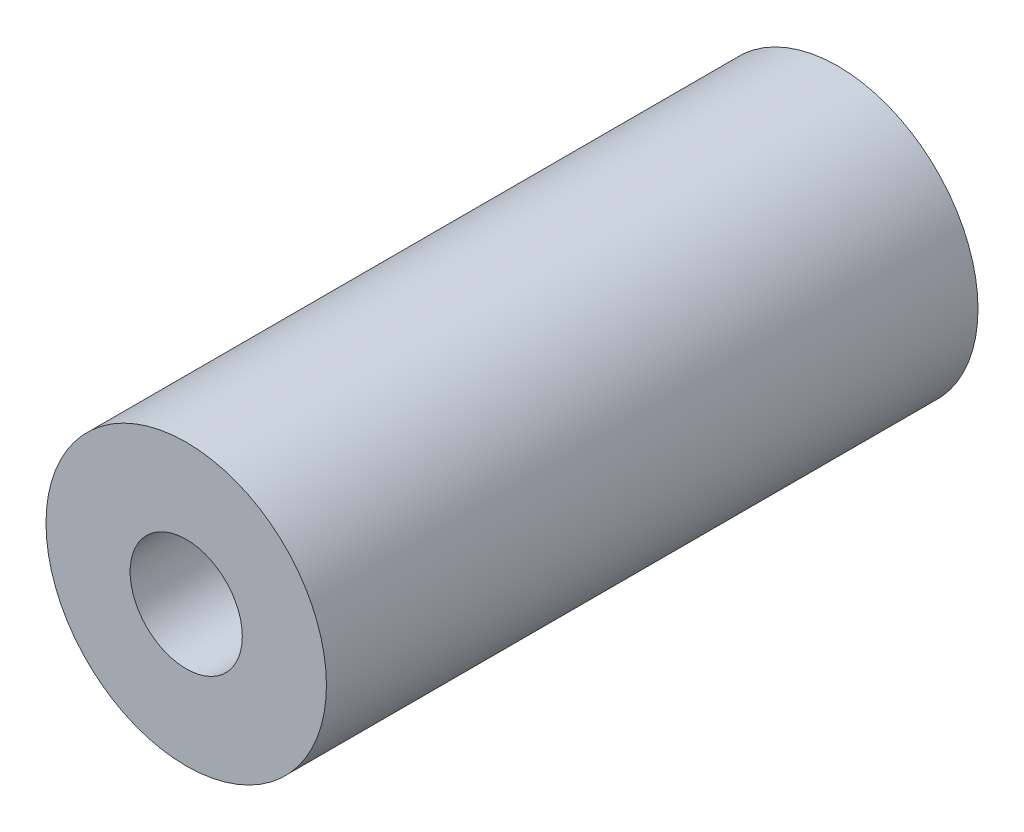
from build123d import *

# Parameters (mm, degrees)
CROQUIS1_R              = 4.25
CROQUIS1_R_2            = 1.7
SALIENTE_EXTRUIR1_DEPTH = 19.75


with BuildPart() as part:
    # Croquis1 → Saliente-Extruir1 (new body)
    with BuildSketch(Plane.XY):
        Circle(CROQUIS1_R)
        Circle(CROQUIS1_R_2, mode=Mode.SUBTRACT)
    extrude(amount=SALIENTE_EXTRUIR1_DEPTH)


solid = part.part
